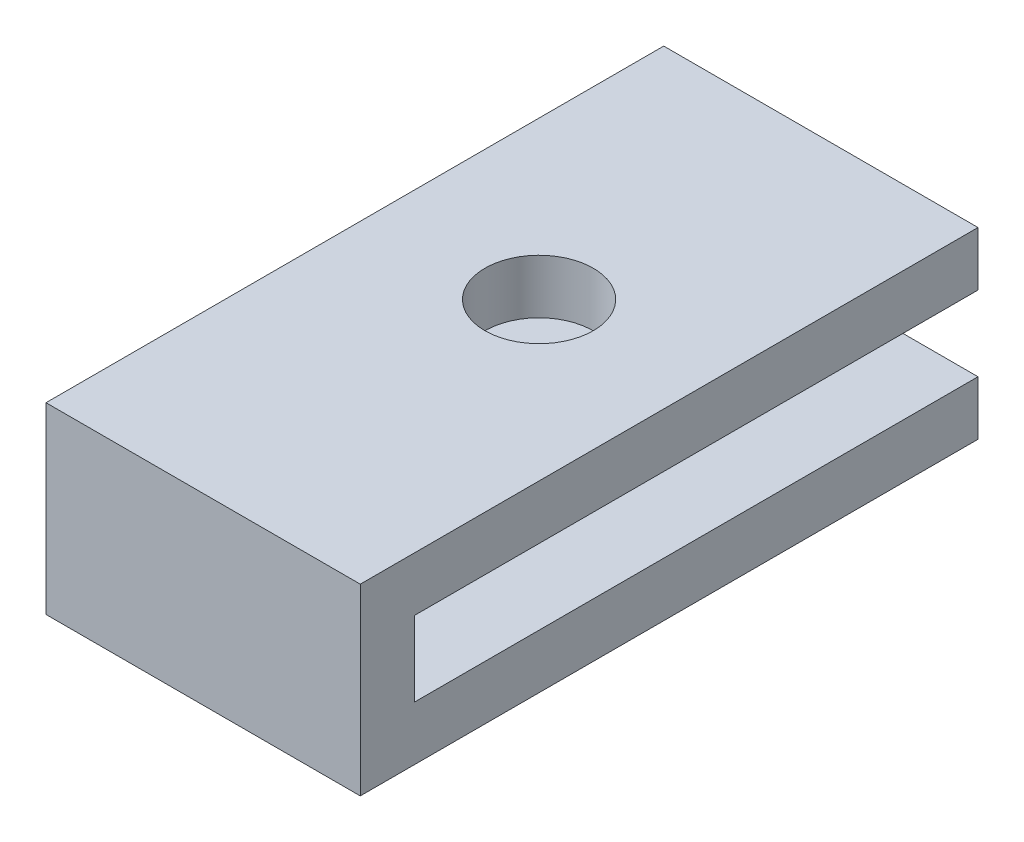
from build123d import *

# Parameters (mm, degrees)
SKETCH1_W           = 14.732
SKETCH1_H           = 26.416
SKETCH1_R           = 2.54
BOSS_EXTRUDE1_DEPTH = 8.5979
SKETCH2_W           = 14.732
SKETCH2_H           = 8.5979
BOSS_EXTRUDE2_DEPTH = 2.54
SKETCH3_W           = 26.416
SKETCH3_H           = 3.5179
CUT_EXTRUDE1_DEPTH  = 25.4


with BuildPart() as part:
    # Sketch1 → Boss-Extrude1 (new body)
    with BuildSketch(Plane(origin=(0, 0, 0), x_dir=(1, 0, 0), z_dir=(0, 1, 0))):
        with Locations((7.366, 13.208)):
            Rectangle(SKETCH1_W, SKETCH1_H)
        with Locations(Location((7.366, 13.208, 0), (0, 0, 270))):
            Circle(SKETCH1_R, mode=Mode.SUBTRACT)
    extrude(amount=BOSS_EXTRUDE1_DEPTH)

    # Sketch2 → Boss-Extrude2 (add)
    with BuildSketch(Plane.XY):
        with Locations((7.366, 4.29895)):
            Rectangle(SKETCH2_W, SKETCH2_H)
    extrude(amount=BOSS_EXTRUDE2_DEPTH)

    # Sketch3 → Cut-Extrude1 (cut)
    with BuildSketch(Plane(origin=(14.732, 0, 0), x_dir=(0, 0, -1), z_dir=(1, 0, 0))):
        with Locations((13.208, 4.29895)):
            Rectangle(SKETCH3_W, SKETCH3_H)
    extrude(amount=-CUT_EXTRUDE1_DEPTH, mode=Mode.SUBTRACT)


solid = part.part
